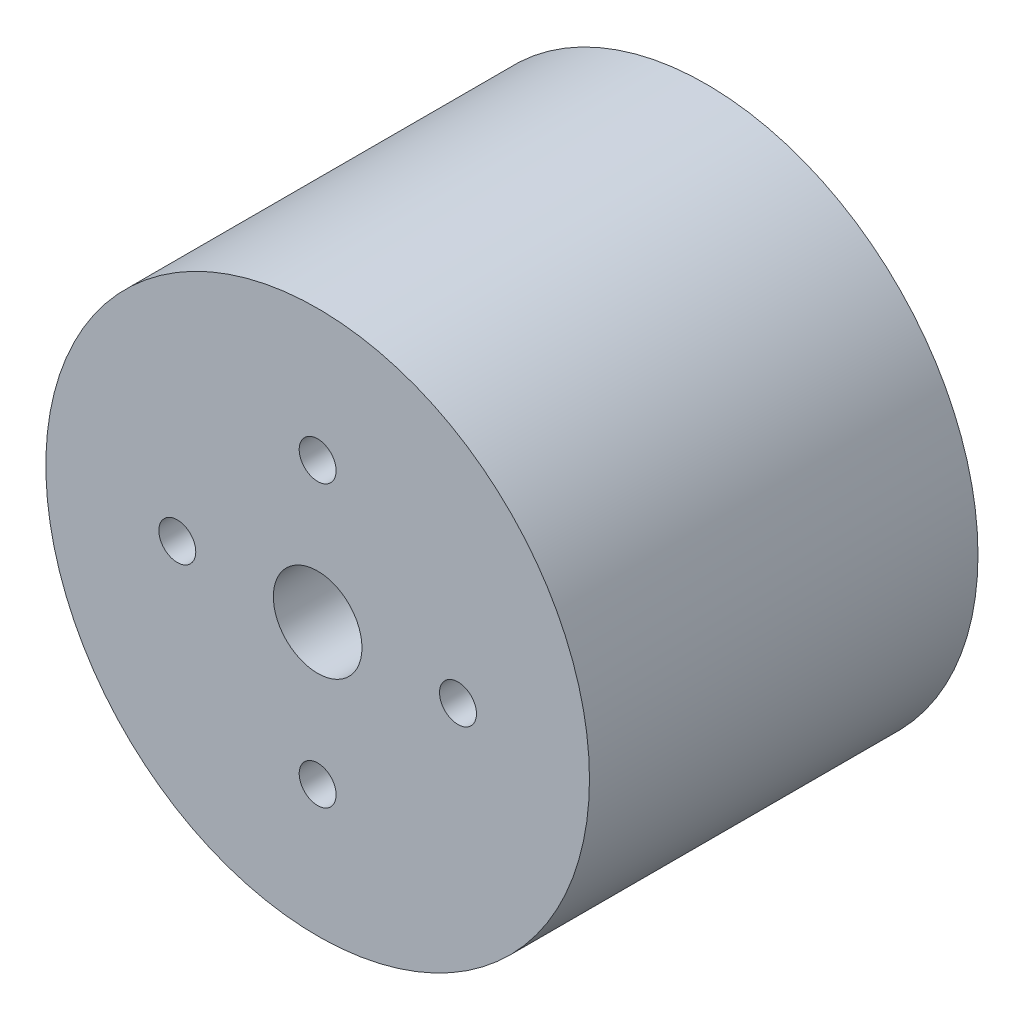
from build123d import *

# Parameters (mm, degrees)
CROQUIS1_R              = 18.4
SALIENTE_EXTRUIR1_DEPTH = 26.3
CROQUIS2_R              = 3
CROQUIS2_R_2            = 1.25
CORTAR_EXTRUIR1_DEPTH   = 5
CROQUIS3_R              = 1.25
CORTAR_EXTRUIR2_DEPTH   = 5


with BuildPart() as part:
    # Croquis1 → Saliente-Extruir1 (new body)
    with BuildSketch(Plane.XY):
        Circle(CROQUIS1_R)
    extrude(amount=SALIENTE_EXTRUIR1_DEPTH)

    # Croquis2 → Cortar-Extruir1 (cut)
    with BuildSketch(Plane.XY.offset(26.3)):
        Circle(CROQUIS2_R)
        with Locations((0, 9.5)):
            Circle(CROQUIS2_R_2)
        with Locations((9.5, 0)):
            Circle(CROQUIS2_R_2)
        with Locations((0, -9.5)):
            Circle(CROQUIS2_R_2)
        with Locations((-9.5, 0)):
            Circle(CROQUIS2_R_2)
    extrude(amount=-CORTAR_EXTRUIR1_DEPTH, mode=Mode.SUBTRACT)

    # Croquis3 → Cortar-Extruir2 (cut)
    with BuildSketch(Plane(origin=(0, 0, 0), x_dir=(-1, 0, 0), z_dir=(0, 0, -1))):
        with Locations((-10, 0)):
            Circle(CROQUIS3_R)
        with Locations((0, 10)):
            Circle(CROQUIS3_R)
        with Locations((10, 0)):
            Circle(CROQUIS3_R)
        with Locations((0, -10)):
            Circle(CROQUIS3_R)
    extrude(amount=-CORTAR_EXTRUIR2_DEPTH, mode=Mode.SUBTRACT)


solid = part.part
